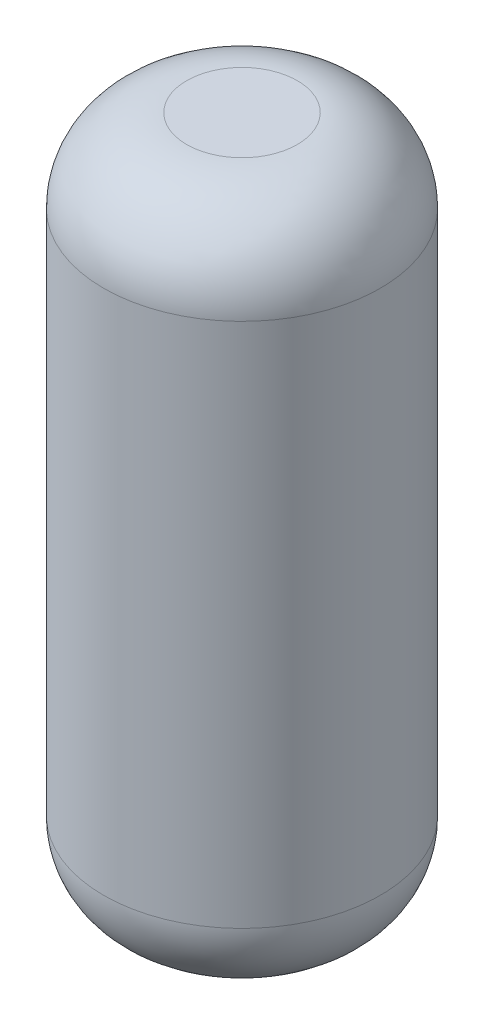
from build123d import *

# Parameters (mm, degrees)
SKETCH1_R           = 5
BOSS_EXTRUDE1_DEPTH = 25
FILLET2_R           = 3


with BuildPart() as part:
    # Sketch1 → Boss-Extrude1 (new body)
    with BuildSketch(Plane(origin=(0, 0, 0), x_dir=(1, 0, 0), z_dir=(0, 1, 0))):
        with Locations(Location((0, 0, 0), (0, 0, 270))):
            Circle(SKETCH1_R)
    extrude(amount=BOSS_EXTRUDE1_DEPTH)

    # Fillet2
    fillet2_edges = [part.edges().sort_by_distance(p)[0] for p in [
        (0, 0, -5),
        (0, 25, -5),
    ]]
    fillet(fillet2_edges, radius=FILLET2_R)


solid = part.part
